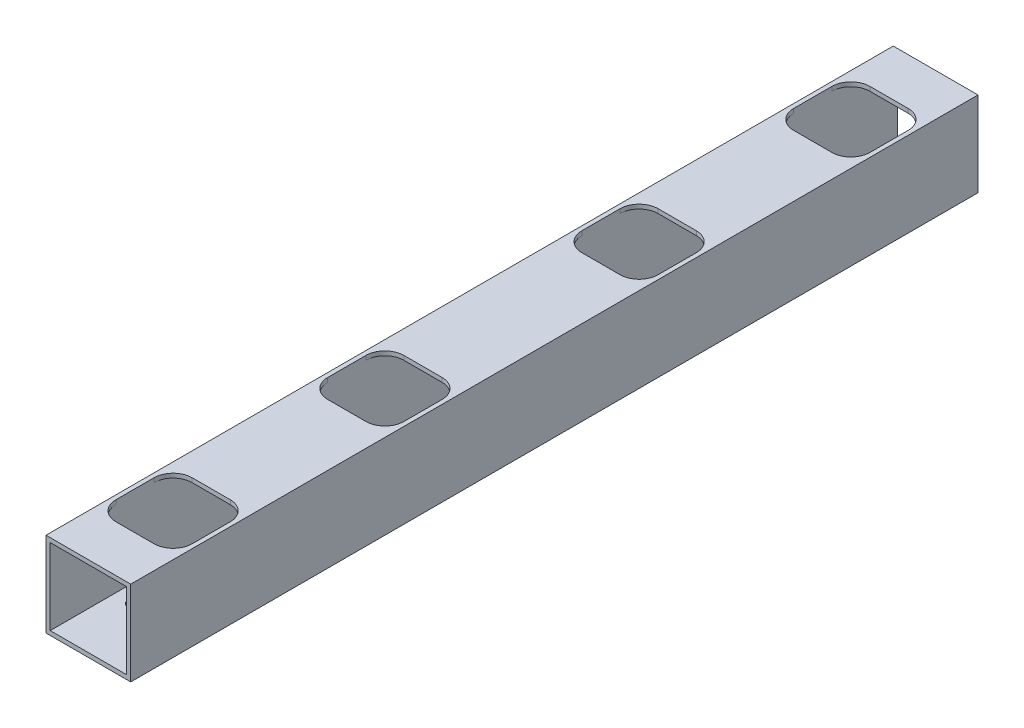
from build123d import *

# Parameters (mm, degrees)
SKETCH_1_W          = 20
SKETCH_1_H          = 20
SKETCH_1_W_2        = 18
SKETCH_1_H_2        = 18
EXTRUDE_1_DEPTH     = 200
SKETCH_3_R          = 1.6
CUT_EXTRUDE_1_DEPTH = 202.246117975
CUT_EXTRUDE_2_REACH = 203.246


with BuildPart() as part:
    # 草图1 → 凸台-拉伸1 (new body)
    with BuildSketch(Plane.XY):
        Rectangle(SKETCH_1_W, SKETCH_1_H)
        Rectangle(SKETCH_1_W_2, SKETCH_1_H_2, mode=Mode.SUBTRACT)
    extrude(amount=EXTRUDE_1_DEPTH)

    # 草图3 → 切除-拉伸1 (cut, through all)
    with BuildSketch(Plane(origin=(0, 10, 0), x_dir=(1, 0, 0), z_dir=(0, 1, 0))):
        with Locations(Location((-4.5, -134.5, 0), (0, 0, 270))):
            Circle(SKETCH_3_R)
        with Locations(Location((4.5, -134.5, 0), (0, 0, 270))):
            Circle(SKETCH_3_R)
        with Locations(Location((4.5, -125.5, 0), (0, 0, 270))):
            Circle(SKETCH_3_R)
        with Locations(Location((-4.5, -125.5, 0), (0, 0, 270))):
            Circle(SKETCH_3_R)
        with Locations(Location((4.5, -65.5, 0), (0, 0, 270))):
            Circle(SKETCH_3_R)
        with Locations(Location((4.5, -74.5, 0), (0, 0, 270))):
            Circle(SKETCH_3_R)
        with Locations(Location((-4.5, -74.5, 0), (0, 0, 270))):
            Circle(SKETCH_3_R)
        with Locations(Location((-4.5, -65.5, 0), (0, 0, 270))):
            Circle(SKETCH_3_R)
        with Locations(Location((-4.5, -184.5, 0), (0, 0, 270))):
            Circle(SKETCH_3_R)
        with Locations(Location((4.5, -184.5, 0), (0, 0, 270))):
            Circle(SKETCH_3_R)
        with Locations(Location((4.5, -175.5, 0), (0, 0, 270))):
            Circle(SKETCH_3_R)
        with Locations(Location((-4.5, -175.5, 0), (0, 0, 270))):
            Circle(SKETCH_3_R)
        with Locations(Location((-4.5, -24.5, 0), (0, 0, 270))):
            Circle(SKETCH_3_R)
        with Locations(Location((4.5, -24.5, 0), (0, 0, 270))):
            Circle(SKETCH_3_R)
        with Locations(Location((4.5, -15.5, 0), (0, 0, 270))):
            Circle(SKETCH_3_R)
        with Locations(Location((-4.5, -15.5, 0), (0, 0, 270))):
            Circle(SKETCH_3_R)
    extrude(amount=-CUT_EXTRUDE_1_DEPTH, mode=Mode.SUBTRACT)

    # 草图4 → 切除-拉伸2 (cut, up to next)
    with BuildSketch(Plane(origin=(0, 10, 0), x_dir=(1, 0, 0), z_dir=(0, 1, 0)), mode=Mode.PRIVATE) as cut_extrude_2_sk1:
        with BuildLine():
            Line((4.5, -11), (-4.5, -11))
            ThreePointArc((-4.5, -11), (-7.681980515, -12.318019485), (-9, -15.5))
            Line((-9, -15.5), (-9, -24.5))
            ThreePointArc((-9, -24.5), (-7.681980515, -27.681980515), (-4.5, -29))
            Line((-4.5, -29), (4.5, -29))
            ThreePointArc((4.5, -29), (7.681980515, -27.681980515), (9, -24.5))
            Line((9, -24.5), (9, -15.5))
            ThreePointArc((9, -15.5), (7.681980515, -12.318019485), (4.5, -11))
        make_face()
    cut_extrude_2_tool1 = extrude(cut_extrude_2_sk1.sketch, amount=-CUT_EXTRUDE_2_REACH, mode=Mode.PRIVATE) & part.part
    # 草图4 → 切除-拉伸2 (cut, up to next)
    with BuildSketch(Plane(origin=(0, 10, 0), x_dir=(1, 0, 0), z_dir=(0, 1, 0)), mode=Mode.PRIVATE) as cut_extrude_2_sk2:
        with BuildLine():
            Line((4.5, -79), (-4.5, -79))
            ThreePointArc((-4.5, -79), (-7.681980515, -77.681980515), (-9, -74.5))
            Line((-9, -74.5), (-9, -65.5))
            ThreePointArc((-9, -65.5), (-7.681980515, -62.318019485), (-4.5, -61))
            Line((-4.5, -61), (4.5, -61))
            ThreePointArc((4.5, -61), (7.681980515, -62.318019485), (9, -65.5))
            Line((9, -65.5), (9, -74.5))
            ThreePointArc((9, -74.5), (7.681980515, -77.681980515), (4.5, -79))
        make_face()
    cut_extrude_2_tool2 = extrude(cut_extrude_2_sk2.sketch, amount=-CUT_EXTRUDE_2_REACH, mode=Mode.PRIVATE) & part.part
    # 草图4 → 切除-拉伸2 (cut, up to next)
    with BuildSketch(Plane(origin=(0, 10, 0), x_dir=(1, 0, 0), z_dir=(0, 1, 0)), mode=Mode.PRIVATE) as cut_extrude_2_sk3:
        with BuildLine():
            Line((9, -134.5), (9, -125.5))
            ThreePointArc((9, -125.5), (7.681980515, -122.318019485), (4.5, -121))
            Line((4.5, -121), (-4.5, -121))
            ThreePointArc((-4.5, -121), (-7.681980515, -122.318019485), (-9, -125.5))
            Line((-9, -125.5), (-9, -134.5))
            ThreePointArc((-9, -134.5), (-7.681980515, -137.681980515), (-4.5, -139))
            Line((-4.5, -139), (4.5, -139))
            ThreePointArc((4.5, -139), (7.681980515, -137.681980515), (9, -134.5))
        make_face()
    cut_extrude_2_tool3 = extrude(cut_extrude_2_sk3.sketch, amount=-CUT_EXTRUDE_2_REACH, mode=Mode.PRIVATE) & part.part
    # 草图4 → 切除-拉伸2 (cut, up to next)
    with BuildSketch(Plane(origin=(0, 10, 0), x_dir=(1, 0, 0), z_dir=(0, 1, 0)), mode=Mode.PRIVATE) as cut_extrude_2_sk4:
        with BuildLine():
            Line((9, -184.5), (9, -175.5))
            ThreePointArc((9, -175.5), (7.681980515, -172.318019485), (4.5, -171))
            Line((4.5, -171), (-4.5, -171))
            ThreePointArc((-4.5, -171), (-7.681980515, -172.318019485), (-9, -175.5))
            Line((-9, -175.5), (-9, -184.5))
            ThreePointArc((-9, -184.5), (-7.681980515, -187.681980515), (-4.5, -189))
            Line((-4.5, -189), (4.5, -189))
            ThreePointArc((4.5, -189), (7.681980515, -187.681980515), (9, -184.5))
        make_face()
    cut_extrude_2_tool4 = extrude(cut_extrude_2_sk4.sketch, amount=-CUT_EXTRUDE_2_REACH, mode=Mode.PRIVATE) & part.part
    add(cut_extrude_2_tool1.solids().sort_by_distance((0, 10, 20))[0], mode=Mode.SUBTRACT)
    add(cut_extrude_2_tool2.solids().sort_by_distance((0, 10, 70))[0], mode=Mode.SUBTRACT)
    add(cut_extrude_2_tool3.solids().sort_by_distance((0, 10, 130))[0], mode=Mode.SUBTRACT)
    add(cut_extrude_2_tool4.solids().sort_by_distance((0, 10, 180))[0], mode=Mode.SUBTRACT)


solid = part.part
